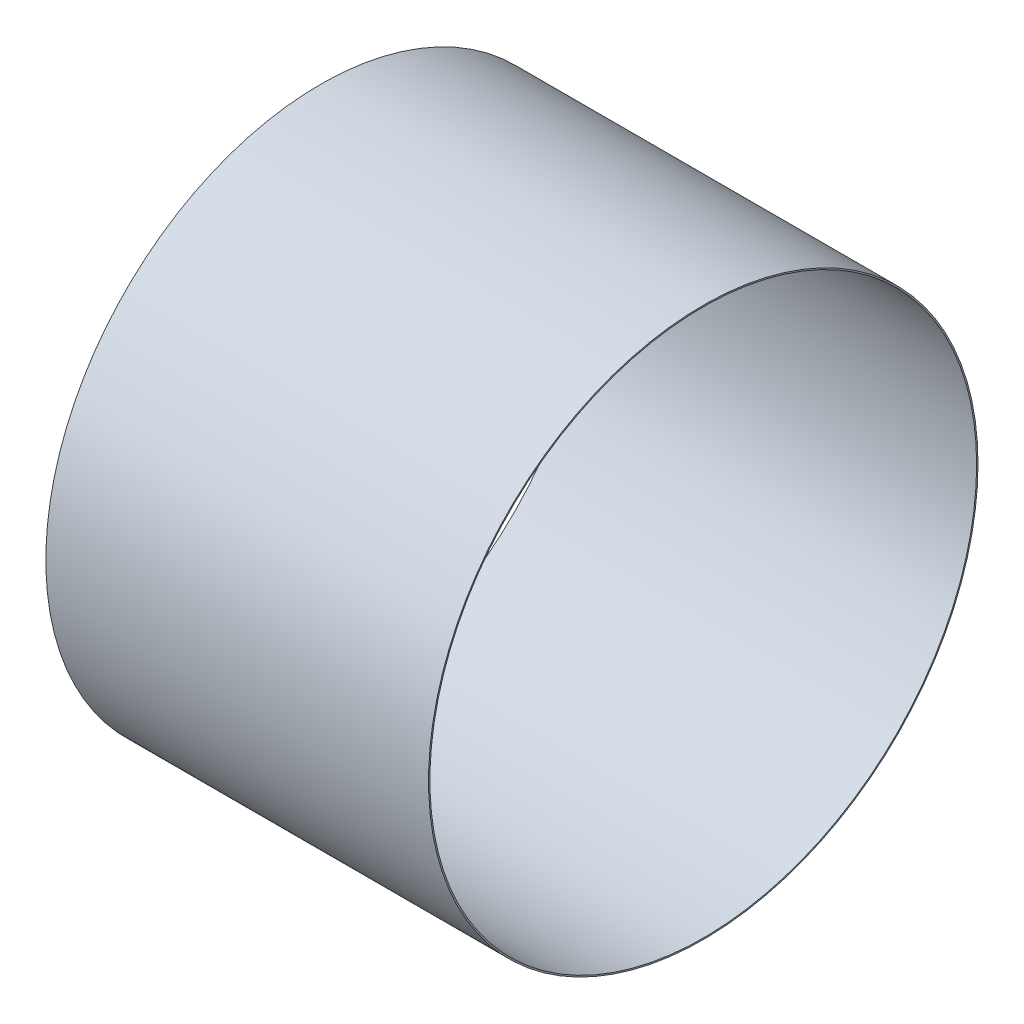
from build123d import *

# Parameters (mm, degrees)
SKETCH1_R           = 638.175
SKETCH1_R_2         = 635
EXTRUDE_THIN2_DEPTH = 889


with BuildPart() as part:
    # Sketch1 → Extrude-Thin2 (new body)
    with BuildSketch(Plane(origin=(0, 0, 0), x_dir=(0, 0, -1), z_dir=(1, 0, 0))):
        Circle(SKETCH1_R)
        Circle(SKETCH1_R_2, mode=Mode.SUBTRACT)
    extrude(amount=EXTRUDE_THIN2_DEPTH)


solid = part.part
